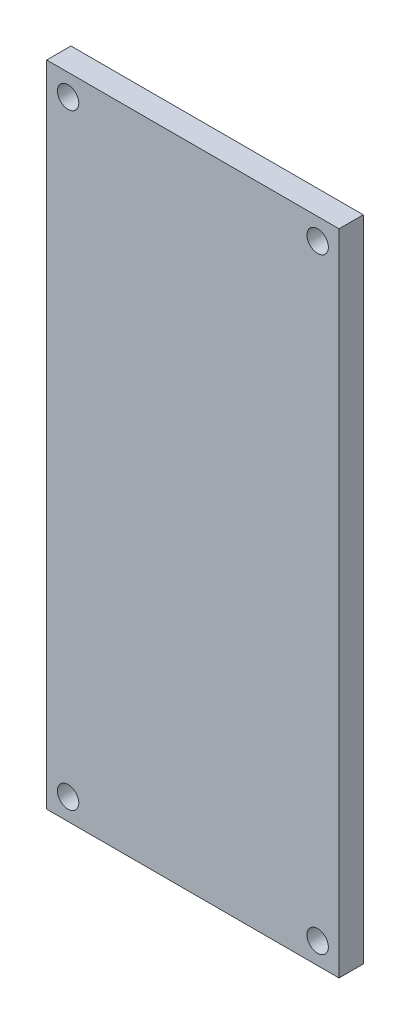
from build123d import *

# Parameters (mm, degrees)
SKETCH1_W          = 20.5
SKETCH1_H          = 45.5
EXTRUDE1_DEPTH     = 1.7
SKETCH2_R          = 0.75
CUT_EXTRUDE1_DEPTH = 1.7


with BuildPart() as part:
    # Sketch1 → Extrude1 (new body)
    with BuildSketch(Plane.XY):
        Rectangle(SKETCH1_W, SKETCH1_H)
    extrude(amount=EXTRUDE1_DEPTH)

    # Sketch2 → Cut-Extrude1 (cut)
    with BuildSketch(Plane.XY.offset(1.7)):
        with Locations((8.75, -21.25)):
            Circle(SKETCH2_R)
        with Locations((-8.75, -21.25)):
            Circle(SKETCH2_R)
        with Locations((-8.75, 21.25)):
            Circle(SKETCH2_R)
        with Locations((8.75, 21.25)):
            Circle(SKETCH2_R)
    extrude(amount=-CUT_EXTRUDE1_DEPTH, mode=Mode.SUBTRACT)


solid = part.part
